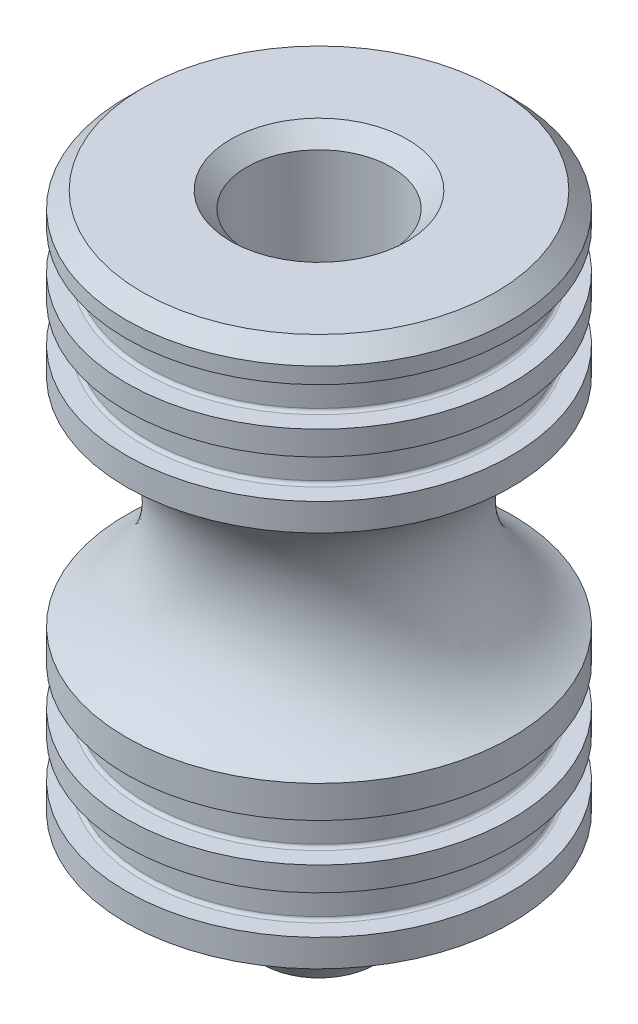
from build123d import *

# Parameters (mm, degrees)
SMUSSO1_SIZE                  = 1
FORO_FILETTATO_M8X1_0_1_D     = 7
FORO_FILETTATO_M8X1_0_1_DEPTH = 6.896987833
FORO_FILETTATO_M8X1_0_1_TIP   = 2.103012167
TAGLIO_ESTRUSIONE1_DEPTH      = 3
RACCORDO1_R                   = 0.2


with BuildPart() as part:
    # Schizzo1 → Rivoluzione2 (revolve)
    with BuildSketch(Plane.XY, mode=Mode.PRIVATE) as rivoluzione2_sk:
        with BuildLine():
            Line((-4.5, 40), (-12, 40))
            Line((-12, 40), (-12, 38))
            Line((-12, 38), (-10.7, 38))
            Line((-10.7, 38), (-10.7, 35.6))
            Line((-10.7, 35.6), (-12, 35.6))
            Line((-12, 35.6), (-12, 34.1))
            Line((-12, 34.1), (-10.7, 34.1))
            Line((-10.7, 34.1), (-10.7, 31.7))
            Line((-10.7, 31.7), (-12, 31.7))
            Line((-12, 31.7), (-12, 30))
            ThreePointArc((-12, 30), (-7.769174208, 23.25), (-12, 16.5))
            Line((-12, 16.5), (-12, 14.5))
            Line((-12, 14.5), (-10.7, 14.5))
            Line((-10.7, 14.5), (-10.7, 12.1))
            Line((-10.7, 12.1), (-12, 12.1))
            Line((-12, 12.1), (-12, 10.6))
            Line((-12, 10.6), (-10.7, 10.6))
            Line((-10.7, 10.6), (-10.7, 8.2))
            Line((-10.7, 8.2), (-12, 8.2))
            Line((-12, 8.2), (-12, 6.5))
            ThreePointArc((-12, 6.5), (-7.132565137, 4.057414821), (-3.5, 0))
            Line((-3.5, 0), (0, 0))
            Line((0, 0), (0, 18))
            Line((0, 18), (-4.5, 18))
            Line((-4.5, 18), (-4.5, 40))
        make_face()
    revolve(rivoluzione2_sk.sketch.rotate(Axis((0, 0, 0), (0, 1, 0)), 270), axis=Axis((0, 0, 0), (0, 1, 0)))

    # Smusso1
    smusso1_edges = [part.edges().sort_by_distance(p)[0] for p in [
        (0, 40, 12),
        (0, 40, 4.5),
    ]]
    chamfer(smusso1_edges, length=SMUSSO1_SIZE)

    # Foro filettato M8x1.0-1
    with Locations(Plane(origin=(0, 18, 0), x_dir=(1, 0, 0), z_dir=(0, 1, 0))):
        with Locations((0, 0)):
            Hole(FORO_FILETTATO_M8X1_0_1_D / 2, depth=FORO_FILETTATO_M8X1_0_1_DEPTH)
            with Locations((0, 0, -(FORO_FILETTATO_M8X1_0_1_DEPTH + FORO_FILETTATO_M8X1_0_1_TIP / 2))):  # 118° drill point
                Cone(0, FORO_FILETTATO_M8X1_0_1_D / 2, FORO_FILETTATO_M8X1_0_1_TIP, mode=Mode.SUBTRACT)

    # Schizzo6 → Taglio-Estrusione1 (cut)
    with BuildSketch(Plane.XZ):
        Polygon((0, -2.309401077), (-2, -1.154700538), (-2, 1.154700538), (0, 2.309401077), (2, 1.154700538), (2, -1.154700538), align=None)
    extrude(amount=-TAGLIO_ESTRUSIONE1_DEPTH, mode=Mode.SUBTRACT)

    # Raccordo1
    raccordo1_edges = [part.edges().sort_by_distance(p)[0] for p in [
        (0, 8.2, 10.7),
        (0, 10.6, 10.7),
        (0, 12.1, 10.7),
        (0, 14.5, 10.7),
        (0, 31.7, 10.7),
        (0, 34.1, 10.7),
        (0, 35.6, 10.7),
        (0, 38, 10.7),
    ]]
    fillet(raccordo1_edges, radius=RACCORDO1_R)


solid = part.part
